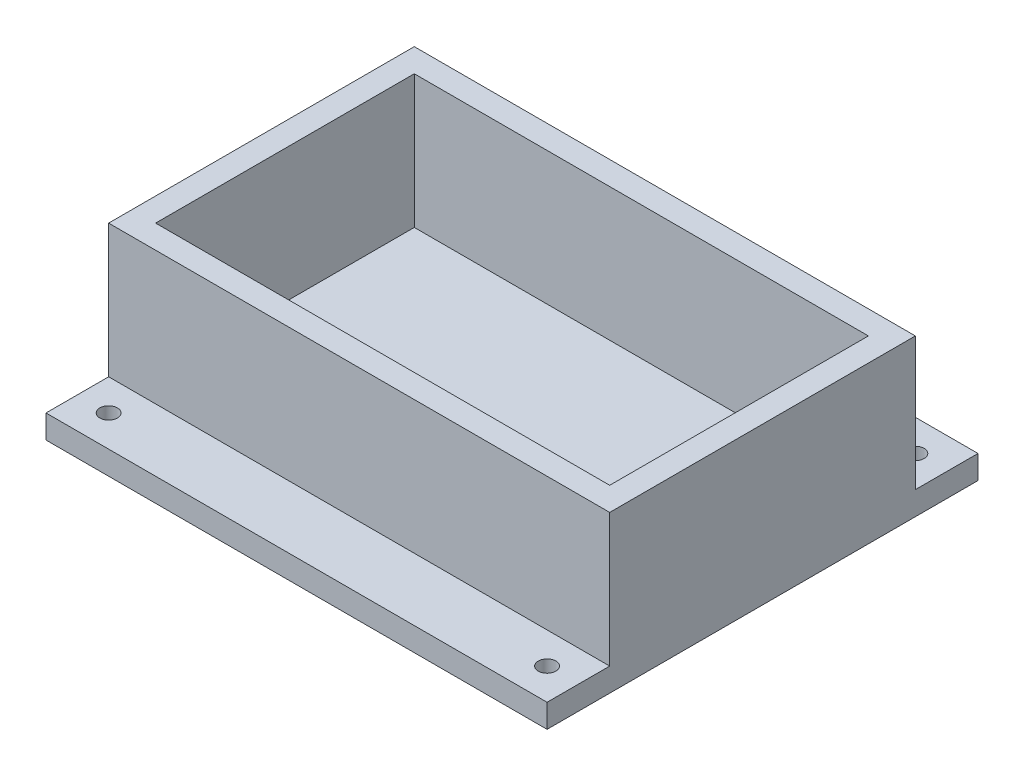
from build123d import *

# Parameters (mm, degrees)
SKETCH2_W              = 203.2
SKETCH2_H              = 123.952
MAIN_BLOCK_DEPTH       = 63.5
SHELL_T                = -9.525
SKETCH6_W              = 203.2
SKETCH6_H              = 25.4
SKETCH6_R              = 3.5687
MOUNTING_FLANGES_DEPTH = 9.525


with BuildPart() as part:
    # Sketch2 → Main Block (new body)
    with BuildSketch(Plane(origin=(0, 0, 0), x_dir=(1, 0, 0), z_dir=(0, 1, 0))):
        Rectangle(SKETCH2_W, SKETCH2_H)
    extrude(amount=MAIN_BLOCK_DEPTH)

    # Shell
    shell_openings = [part.faces().sort_by_distance(p)[0] for p in [
        (0, 63.5, 0),
    ]]
    offset(amount=SHELL_T, openings=shell_openings, kind=Kind.INTERSECTION)

    # Sketch6 → Mounting Flanges (add)
    # profile 1 of 2: a face of its own
    with BuildSketch(Plane(origin=(0, 9.525, 0), x_dir=(1, 0, 0), z_dir=(0, 1, 0))):
        with Locations((0, 74.676)):
            Rectangle(SKETCH6_W, SKETCH6_H)
        with Locations(Location((-88.9, 74.676, 0), (0, 0, 270))):
            Circle(SKETCH6_R, mode=Mode.SUBTRACT)
        with Locations(Location((88.9, 74.676, 0), (0, 0, 270))):
            Circle(SKETCH6_R, mode=Mode.SUBTRACT)
    # profile 2 of 2: a face of its own
    with BuildSketch(Plane(origin=(0, 9.525, 0), x_dir=(1, 0, 0), z_dir=(0, 1, 0))):
        with Locations((0, -74.676)):
            Rectangle(SKETCH6_W, SKETCH6_H)
        with Locations(Location((88.9, -74.676, 0), (0, 0, 270))):
            Circle(SKETCH6_R, mode=Mode.SUBTRACT)
        with Locations(Location((-88.9, -74.676, 0), (0, 0, 270))):
            Circle(SKETCH6_R, mode=Mode.SUBTRACT)
    extrude(amount=-MOUNTING_FLANGES_DEPTH)


solid = part.part
